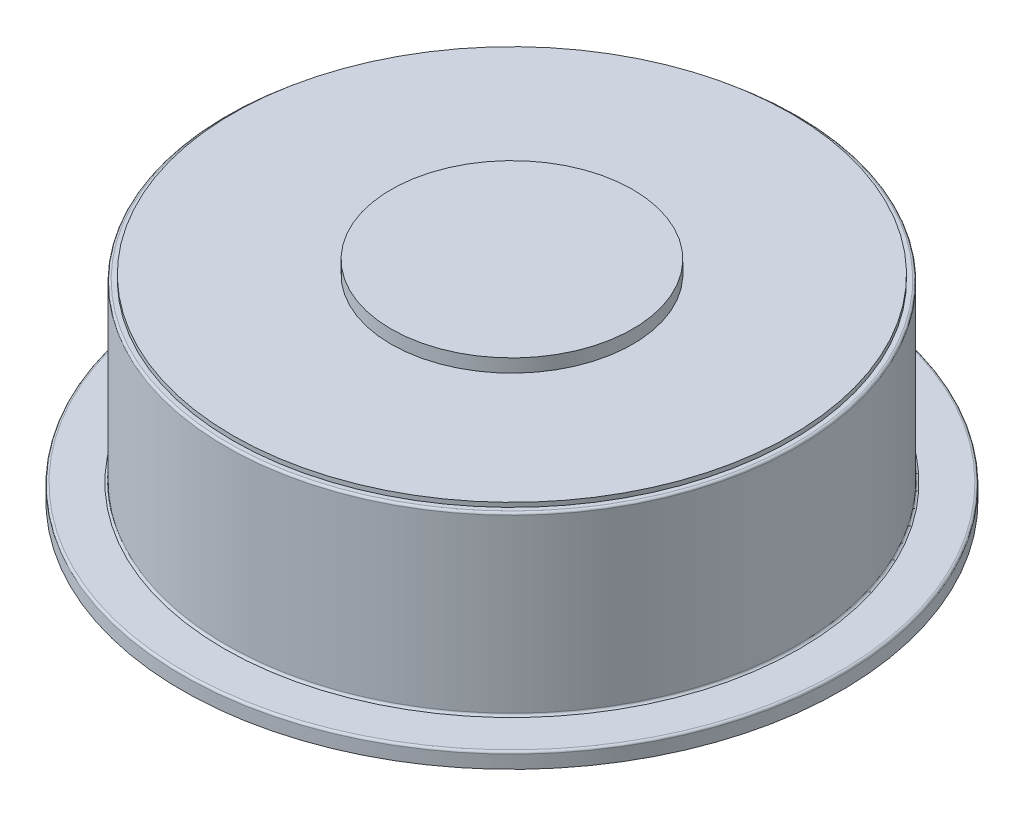
from build123d import *

# Parameters (mm, degrees)
IZIM2_W                     = 150
IZIM2_H                     = 7
IZIM2_W_2                   = 130
IZIM2_H_2                   = 80
IZIM3_R                     = 127
Y_KSEKLIK_EKSTR_ZYON1_DEPTH = 2
RADYUS1_R                   = 1
RADYUS2_R                   = 1
IZIM5_R                     = 55
Y_KSEKLIK_EKSTR_ZYON2_DEPTH = 6


with BuildPart() as part:
    # Çizim2 → Döndür1 (revolve)
    with BuildSketch(Plane.XY, mode=Mode.PRIVATE) as d_nd_r1_sk:
        with Locations((-75, 3.5)):
            Rectangle(IZIM2_W, IZIM2_H)
        with Locations((-65, 47)):
            Rectangle(IZIM2_W_2, IZIM2_H_2)
    revolve(d_nd_r1_sk.sketch.rotate(Axis((0, 7, 0), (0, 1, 0)), 270), axis=Axis((0, 7, 0), (0, 1, 0)))

    # Çizim3 → Yükseklik-Ekstrüzyon1 (add)
    with BuildSketch(Plane(origin=(0, 87, 0), x_dir=(1, 0, 0), z_dir=(0, 1, 0))):
        with Locations(Location((0, 0, 0), (0, 0, 270))):
            Circle(IZIM3_R)
    extrude(amount=Y_KSEKLIK_EKSTR_ZYON1_DEPTH)

    # Radyus1
    radyus1_edges = [part.edges().sort_by_distance(p)[0] for p in [
        (0, 87, 130),
        (0, 7, 130),
    ]]
    fillet(radyus1_edges, radius=RADYUS1_R)

    # Radyus2
    radyus2_edges = [part.edges().sort_by_distance(p)[0] for p in [
        (0, 7, 150),
    ]]
    fillet(radyus2_edges, radius=RADYUS2_R)

    # Çizim5 → Yükseklik-Ekstrüzyon2 (add)
    with BuildSketch(Plane(origin=(0, 89, 0), x_dir=(1, 0, 0), z_dir=(0, 1, 0))):
        with Locations(Location((0, 0, 0), (0, 0, 270))):
            Circle(IZIM5_R)
    extrude(amount=Y_KSEKLIK_EKSTR_ZYON2_DEPTH)


solid = part.part
